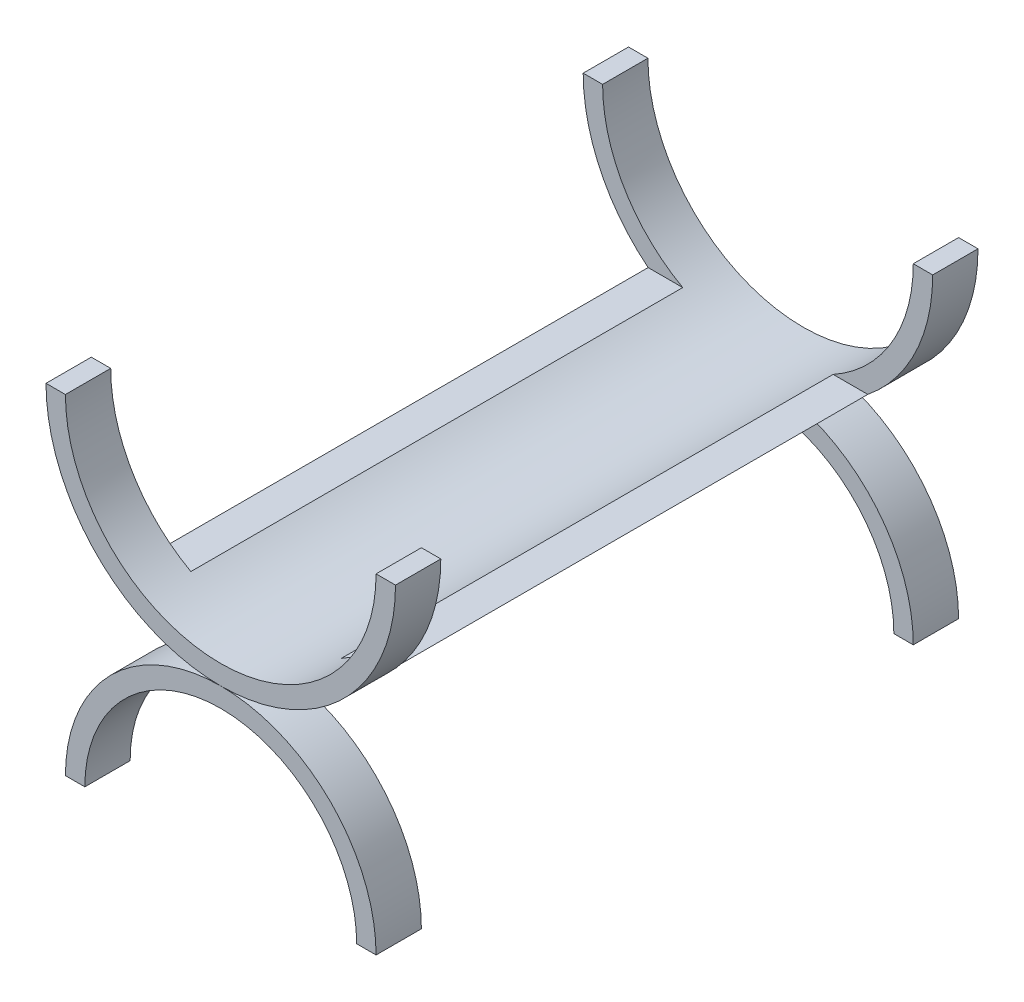
from build123d import *

# Parameters (mm, degrees)
BOSS_EXTRUDE1_DEPTH     = 571.5
CUT_EXTRUDE1_DEPTH      = 750.515223328
CUT_EXTRUDE1_DEPTH_BACK = 750.515223328
SKETCH2_W               = 965.2
SKETCH2_H               = 266.7
BOSS_EXTRUDE2_DEPTH     = 88.9


with BuildPart() as part:
    # Sketch1 → Boss-Extrude1 (new, symmetric)
    with BuildSketch(Plane.XY):
        with BuildLine():
            Line((-342.9, 0), (-304.8, 0))
            ThreePointArc((-304.8, 0), (0, -304.8), (304.8, 0))
            Line((304.8, 0), (342.9, 0))
            ThreePointArc((342.9, 0), (0, -342.9), (-342.9, 0))
        make_face()
    extrude(amount=BOSS_EXTRUDE1_DEPTH, both=True)

    # Sketch2 → Cut-Extrude1 (cut, two sides: drawn at the far end of the back side and taken through both)
    with BuildSketch(Plane(origin=(0, 0, 0), x_dir=(0, 0, -1), z_dir=(1, 0, 0)).offset(-CUT_EXTRUDE1_DEPTH_BACK)):
        with Locations((0, -133.35)):
            Rectangle(SKETCH2_W, SKETCH2_H)
    extrude(amount=CUT_EXTRUDE1_DEPTH + CUT_EXTRUDE1_DEPTH_BACK, mode=Mode.SUBTRACT)


with BuildPart() as body_2:
    # Sketch3 → Boss-Extrude2 (new body)
    with BuildSketch(Plane.XY.offset(571.5)):
        with BuildLine():
            Line((-304.8, -647.7), (-266.7, -647.7))
            ThreePointArc((-266.7, -647.7), (0, -381), (266.7, -647.7))
            Line((266.7, -647.7), (304.8, -647.7))
            ThreePointArc((304.8, -647.7), (0, -342.9), (-304.8, -647.7))
        make_face()
    extrude(amount=-BOSS_EXTRUDE2_DEPTH)


with BuildPart() as body_3:
    # Mirror4: mirrored copy
    add(body_2.part.mirror(Plane.XY))


solid = Compound([part.part, body_2.part, body_3.part])
